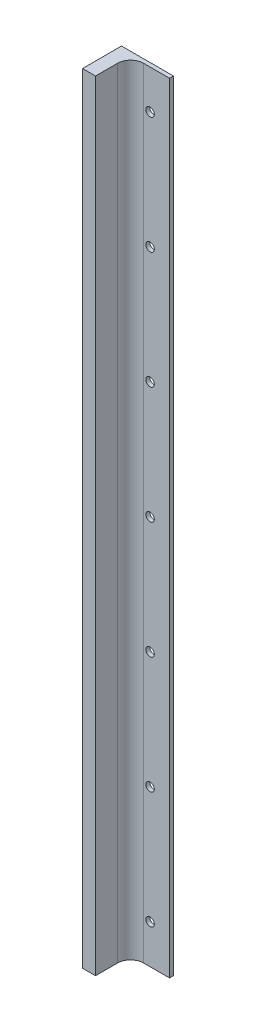
from build123d import *

# Parameters (mm, degrees)
SKETCH1_R           = 3.25
BOSS_EXTRUDE1_DEPTH = 3
SKETCH2_W           = 10
SKETCH2_H           = 600
BOSS_EXTRUDE2_DEPTH = 27
FILLET1_R           = 10


with BuildPart() as part:
    # Sketch1 → Boss-Extrude1 (new body)
    with BuildSketch(Plane.XY):
        Polygon((125, -300), (125, 300), (165, 300), (165, -300), (150, -300), align=None)
        with Locations((150, 270)):
            Circle(SKETCH1_R, mode=Mode.SUBTRACT)
        with Locations((150, 180)):
            Circle(SKETCH1_R, mode=Mode.SUBTRACT)
        with Locations((150, 90)):
            Circle(SKETCH1_R, mode=Mode.SUBTRACT)
        with Locations((150, 0)):
            Circle(SKETCH1_R, mode=Mode.SUBTRACT)
        with Locations((150, -90)):
            Circle(SKETCH1_R, mode=Mode.SUBTRACT)
        with Locations((150, -180)):
            Circle(SKETCH1_R, mode=Mode.SUBTRACT)
        with Locations((150, -270)):
            Circle(SKETCH1_R, mode=Mode.SUBTRACT)
    extrude(amount=BOSS_EXTRUDE1_DEPTH)

    # Sketch2 → Boss-Extrude2 (add)
    with BuildSketch(Plane.XY.offset(3)):
        with Locations((130, 0)):
            Rectangle(SKETCH2_W, SKETCH2_H)
    extrude(amount=BOSS_EXTRUDE2_DEPTH)

    # Fillet1
    fillet1_edges = [part.edges().sort_by_distance(p)[0] for p in [
        (135, 0, 3),
    ]]
    fillet(fillet1_edges, radius=FILLET1_R)


solid = part.part
